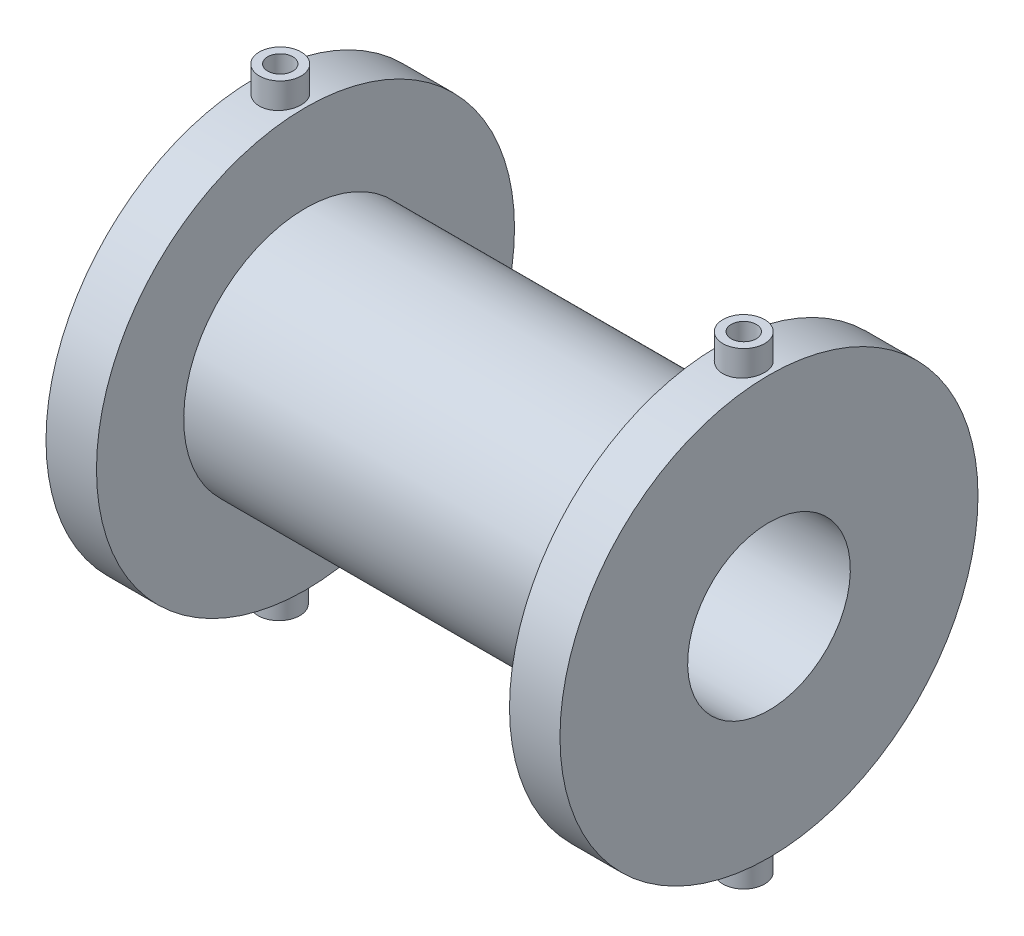
from build123d import *

# Parameters (mm, degrees)
CROQUIS3_R              = 5
SALIENTE_EXTRUIR1_DEPTH = 6
CROQUIS4_R              = 3
CORTAR_EXTRUIR1_DEPTH   = 12
CROQUIS5_R              = 5
SALIENTE_EXTRUIR2_DEPTH = 6
CROQUIS8_R              = 5
SALIENTE_EXTRUIR4_DEPTH = 6
CROQUIS9_R              = 3
CORTAR_EXTRUIR4_DEPTH   = 12
CROQUIS10_R             = 5
SALIENTE_EXTRUIR5_DEPTH = 6
CROQUIS11_R             = 3
CORTAR_EXTRUIR5_DEPTH   = 12
CORTAR_EXTRUIR7_START   = -16
CROQUIS14_R             = 3
CORTAR_EXTRUIR7_DEPTH   = 16


with BuildPart() as part:
    # Camisa → Revolución3 (revolve)
    with BuildSketch(Plane.XY):
        Polygon((-61.6, 19.5), (61.6, 19.5), (61.6, 50.1), (49.5, 50.1), (49.5, 29.193885615), (-49.5, 29.193885615), (-49.5, 50.1), (-61.6, 50.1), align=None)
        Polygon((51.5, 48.1), (59.6, 48.1), (59.6, 21.5), (-59.6, 21.5), (-59.6, 48.1), (-51.5, 48.1), (-51.5, 27.193885615), (51.5, 27.193885615), align=None, mode=Mode.SUBTRACT)
    revolve(axis=Axis((125, 0, 0), (-1, 0, 0)))

    # Croquis3 → Saliente-Extruir1 (add, symmetric)
    with BuildSketch(Plane(origin=(0, 50.1, 0), x_dir=(1, 0, 0), z_dir=(0, 1, 0))):
        with Locations(Location((-55.55, 0, 0), (0, 0, 180))):
            Circle(CROQUIS3_R)
    extrude(amount=SALIENTE_EXTRUIR1_DEPTH, both=True)

    # Croquis4 → Cortar-Extruir1 (cut)
    with BuildSketch(Plane(origin=(0, 56.1, 0), x_dir=(1, 0, 0), z_dir=(0, 1, 0))):
        with Locations(Location((-55.55, 0, 0), (0, 0, 180))):
            Circle(CROQUIS4_R)
    extrude(amount=-CORTAR_EXTRUIR1_DEPTH, mode=Mode.SUBTRACT)

    # Croquis5 → Saliente-Extruir2 (add, symmetric)
    with BuildSketch(Plane(origin=(0, 50.1, 0), x_dir=(1, 0, 0), z_dir=(0, 1, 0))):
        with Locations(Location((55.55, 0, 0), (0, 0, 180))):
            Circle(CROQUIS5_R)
    extrude(amount=SALIENTE_EXTRUIR2_DEPTH, both=True)

    # Croquis8 → Saliente-Extruir4 (add, symmetric)
    with BuildSketch(Plane(origin=(0, -50.1, 0), x_dir=(-1, 0, 0), z_dir=(0, -1, 0))):
        with Locations((55.869923699, 0)):
            Circle(CROQUIS8_R)
    extrude(amount=SALIENTE_EXTRUIR4_DEPTH, both=True)

    # Croquis9 → Cortar-Extruir4 (cut)
    with BuildSketch(Plane.XZ.offset(56.1)):
        with Locations((-55.869923699, 0)):
            Circle(CROQUIS9_R)
    extrude(amount=-CORTAR_EXTRUIR4_DEPTH, mode=Mode.SUBTRACT)

    # Croquis10 → Saliente-Extruir5 (add, symmetric)
    with BuildSketch(Plane(origin=(0, -50.1, 0), x_dir=(-1, 0, 0), z_dir=(0, -1, 0))):
        with Locations((-55.55, 0)):
            Circle(CROQUIS10_R)
    extrude(amount=SALIENTE_EXTRUIR5_DEPTH, both=True)

    # Croquis11 → Cortar-Extruir5 (cut)
    with BuildSketch(Plane.XZ.offset(56.1)):
        with Locations((55.55, 0)):
            Circle(CROQUIS11_R)
    extrude(amount=-CORTAR_EXTRUIR5_DEPTH, mode=Mode.SUBTRACT)

    # Croquis14 → Cortar-Extruir7 (cut)
    with BuildSketch(Plane(origin=(0, 56.1, 0), x_dir=(1, 0, 0), z_dir=(0, 1, 0)).offset(CORTAR_EXTRUIR7_START)):
        with Locations((55.55, 0)):
            Circle(CROQUIS14_R)
    extrude(amount=CORTAR_EXTRUIR7_DEPTH, mode=Mode.SUBTRACT)


solid = part.part
